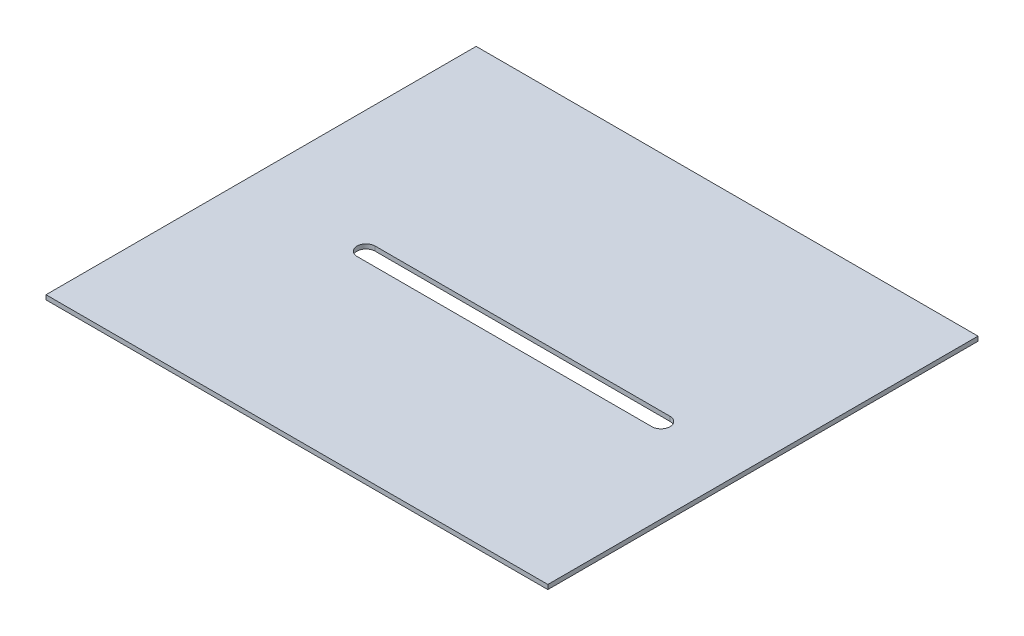
from build123d import *

# Parameters (mm, degrees)
SKETCH1_W           = 355.6
SKETCH1_H           = 304.8
BOSS_EXTRUDE1_DEPTH = 3.175


with BuildPart() as part:
    # Sketch1 → Boss-Extrude1 (new body)
    with BuildSketch(Plane(origin=(0, 0, 0), x_dir=(1, 0, 0), z_dir=(0, 1, 0))):
        with Locations((177.8, 152.4)):
            Rectangle(SKETCH1_W, SKETCH1_H)
        with BuildLine():
            Line((295.660266998, 133.679526168), (86.717406579, 133.679526168))
            ThreePointArc((86.717406579, 133.679526168), (80.30685273, 140.090080017), (86.717406579, 146.500633866))
            Line((86.717406579, 146.500633866), (295.660266998, 146.500633866))
            ThreePointArc((295.660266998, 146.500633866), (302.070820847, 140.090080017), (295.660266998, 133.679526168))
        make_face(mode=Mode.SUBTRACT)
    extrude(amount=BOSS_EXTRUDE1_DEPTH)


solid = part.part
